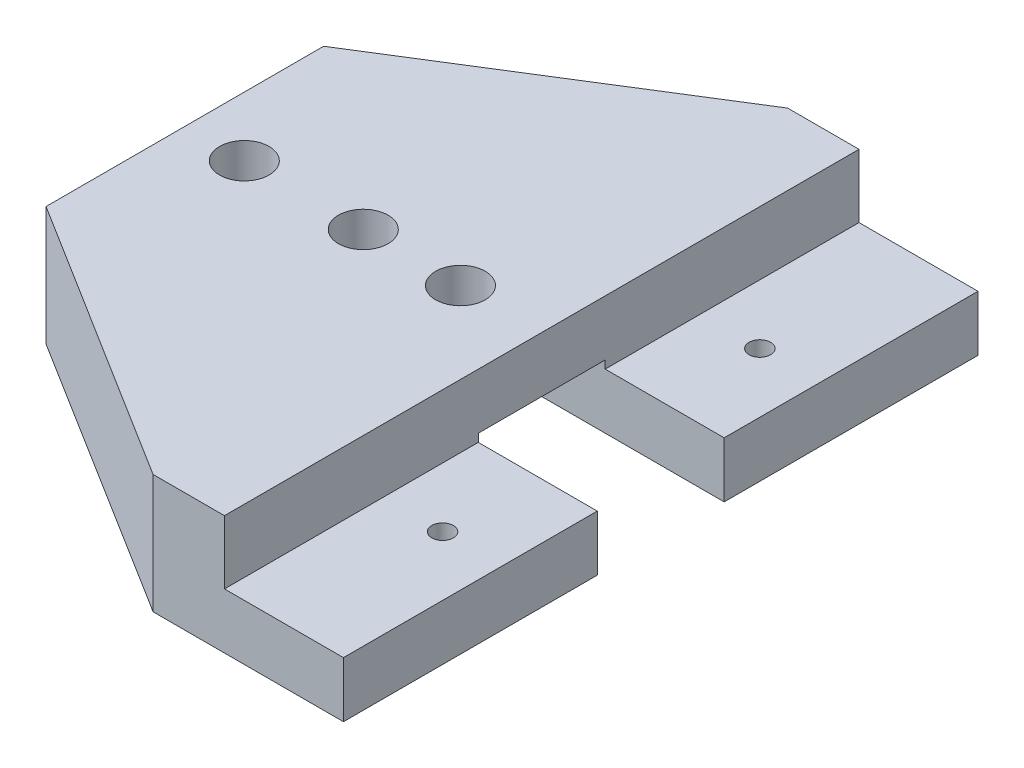
from build123d import *

# Parameters (mm, degrees)
BOSS_EXTRUDE1_DEPTH            = 9.525
SKETCH2_W                      = 76.2
SKETCH2_H                      = 20.32
CUT_EXTRUDE1_DEPTH             = 10.16
SKETCH3_W                      = 19.05
SKETCH3_H                      = 101.6
CUT_EXTRUDE2_DEPTH             = 10.16
F_5_16_0_3125_DIAMETER_HOLE1_D = 7.9375
F_8_32_TAPPED_HOLE1_D          = 3.4544


with BuildPart() as part:
    # Sketch1 → Boss-Extrude1 (new, symmetric)
    with BuildSketch(Plane(origin=(0, 0, 0), x_dir=(1, 0, 0), z_dir=(0, 1, 0))):
        Polygon((-60.96, 22.225), (-60.96, -22.225), (-15.24, -50.8), (15.24, -50.8), (15.24, 50.8), (-15.24, 50.8), align=None)
    extrude(amount=BOSS_EXTRUDE1_DEPTH, both=True)

    # Sketch2 → Cut-Extrude1 (cut)
    with BuildSketch(Plane.XZ.offset(9.525)):
        with Locations((-22.86, 0)):
            Rectangle(SKETCH2_W, SKETCH2_H)
    extrude(amount=-CUT_EXTRUDE1_DEPTH, mode=Mode.SUBTRACT)

    # Sketch3 → Cut-Extrude2 (cut)
    with BuildSketch(Plane(origin=(0, 9.525, 0), x_dir=(1, 0, 0), z_dir=(0, 1, 0))):
        with Locations((5.715, 0)):
            Rectangle(SKETCH3_W, SKETCH3_H)
    extrude(amount=-CUT_EXTRUDE2_DEPTH, mode=Mode.SUBTRACT)

    # 5/16 (0.3125) Diameter Hole1 (through all)
    with Locations(Plane(origin=(0, 9.525, 0), x_dir=(1, 0, 0), z_dir=(0, 1, 0))):
        with Locations((-51.435, 0), (-32.385, 0), (-16.8275, 0)):
            Hole(F_5_16_0_3125_DIAMETER_HOLE1_D / 2)

    # #8-32 Tapped Hole1 (through all)
    with Locations(Plane(origin=(0, -9.525, 0), x_dir=(-1, 0, 0), z_dir=(0, -1, 0))):
        with Locations((-5.715, -25.4), (-5.715, 25.4)):
            Hole(F_8_32_TAPPED_HOLE1_D / 2)


solid = part.part
